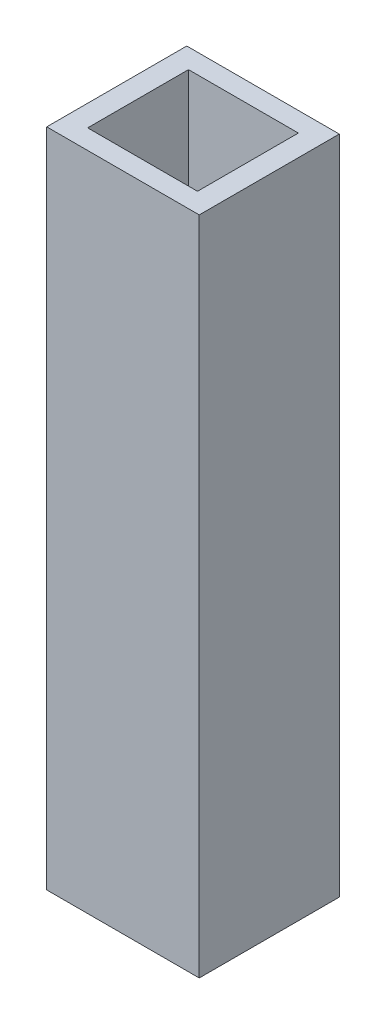
from build123d import *

# Parameters (mm, degrees)
CROQUIS1_W              = 30
CROQUIS1_H              = 27.545454546
CROQUIS1_W_2            = 21.608448052
CROQUIS1_H_2            = 19.84048412
SALIENTE_EXTRUIR1_DEPTH = 130


with BuildPart() as part:
    # Croquis1 → Saliente-Extruir1 (new body)
    with BuildSketch(Plane(origin=(0, 0, 0), x_dir=(1, 0, 0), z_dir=(0, 1, 0))):
        Rectangle(CROQUIS1_W, CROQUIS1_H)
        Rectangle(CROQUIS1_W_2, CROQUIS1_H_2, mode=Mode.SUBTRACT)
    extrude(amount=SALIENTE_EXTRUIR1_DEPTH)


solid = part.part
